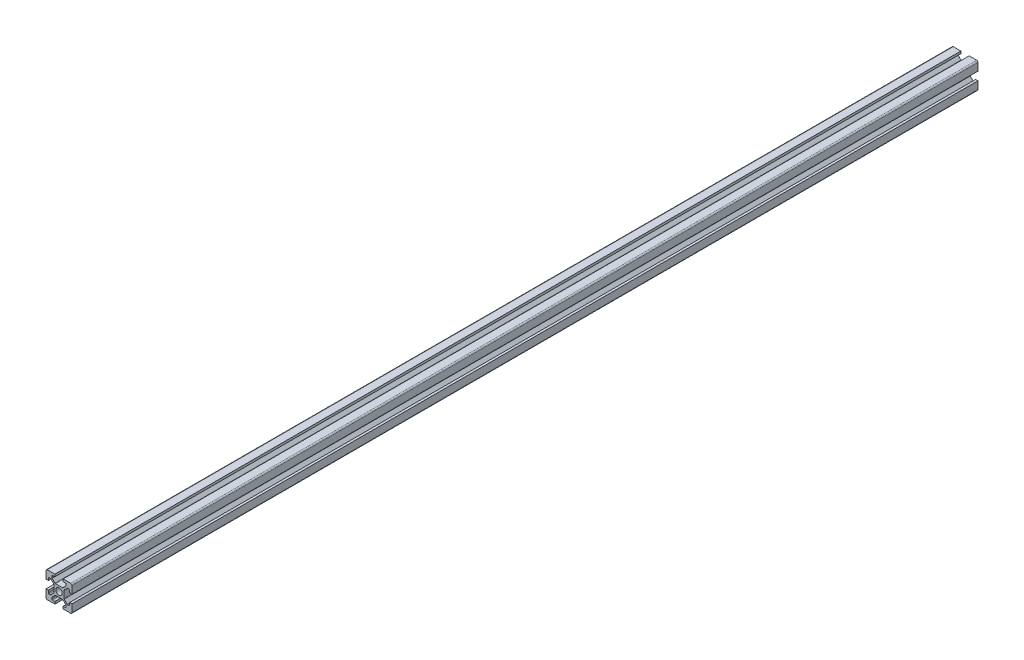
from build123d import *

# Parameters (mm, degrees)
SKETCH1_R           = 2.5
BOSS_EXTRUDE1_DEPTH = 697.1
FILLET1_R           = 1
FILLET2_R           = 0.5
FILLET3_R           = 0.5
FILLET4_R           = 0.5
FILLET5_R           = 0.5


with BuildPart() as part:
    # Sketch1 → Boss-Extrude1 (new body)
    with BuildSketch(Plane.XY):
        Polygon((13.2, 0), (13.2, 1.8), (15.45, 1.8), (15.45, 3.6), (12.95, 6.1), (7.05, 6.1), (4.55, 3.6), (4.55, 1.8), (6.8, 1.8), (6.8, 0), (0, 0), (0, 6.8), (1.8, 6.8), (1.8, 4.55), (3.6, 4.55), (6.1, 7.05), (6.1, 12.95), (3.6, 15.45), (1.8, 15.45), (1.8, 13.2), (0, 13.2), (0, 20), (6.8, 20), (6.8, 18.2), (4.55, 18.2), (4.55, 16.4), (7.05, 13.9), (12.95, 13.9), (15.45, 16.4), (15.45, 18.2), (13.2, 18.2), (13.2, 20), (20, 20), (20, 13.2), (18.2, 13.2), (18.2, 15.45), (16.4, 15.45), (13.9, 12.95), (13.9, 7.05), (16.4, 4.55), (18.2, 4.55), (18.2, 6.8), (20, 6.8), (20, 0), align=None)
        with Locations(Location((10, 10, 0), (0, 0, 180))):
            Circle(SKETCH1_R, mode=Mode.SUBTRACT)
    extrude(amount=BOSS_EXTRUDE1_DEPTH)

    # Fillet1
    fillet1_edges = [part.edges().sort_by_distance(p)[0] for p in [
        (0, 0, 348.55),
        (0, 20, 348.55),
        (20, 20, 348.55),
        (20, 0, 348.55),
    ]]
    fillet(fillet1_edges, radius=FILLET1_R)

    # Fillet2
    fillet2_edges = [part.edges().sort_by_distance(p)[0] for p in [
        (4.55, 18.2, 348.55),
        (4.55, 16.4, 348.55),
        (7.05, 13.9, 348.55),
        (12.95, 13.9, 348.55),
        (15.45, 16.4, 348.55),
        (15.45, 18.2, 348.55),
    ]]
    fillet(fillet2_edges, radius=FILLET2_R)

    # Fillet3
    fillet3_edges = [part.edges().sort_by_distance(p)[0] for p in [
        (18.2, 15.45, 348.55),
        (16.4, 15.45, 348.55),
        (13.9, 12.95, 348.55),
        (13.9, 7.05, 348.55),
        (16.4, 4.55, 348.55),
        (18.2, 4.55, 348.55),
    ]]
    fillet(fillet3_edges, radius=FILLET3_R)

    # Fillet4
    fillet4_edges = [part.edges().sort_by_distance(p)[0] for p in [
        (1.8, 4.55, 348.55),
        (3.6, 4.55, 348.55),
        (6.1, 7.05, 348.55),
        (6.1, 12.95, 348.55),
        (3.6, 15.45, 348.55),
        (1.8, 15.45, 348.55),
    ]]
    fillet(fillet4_edges, radius=FILLET4_R)

    # Fillet5
    fillet5_edges = [part.edges().sort_by_distance(p)[0] for p in [
        (15.45, 1.8, 348.55),
        (15.45, 3.6, 348.55),
        (12.95, 6.1, 348.55),
        (7.05, 6.1, 348.55),
        (4.55, 3.6, 348.55),
        (4.55, 1.8, 348.55),
    ]]
    fillet(fillet5_edges, radius=FILLET5_R)


solid = part.part
